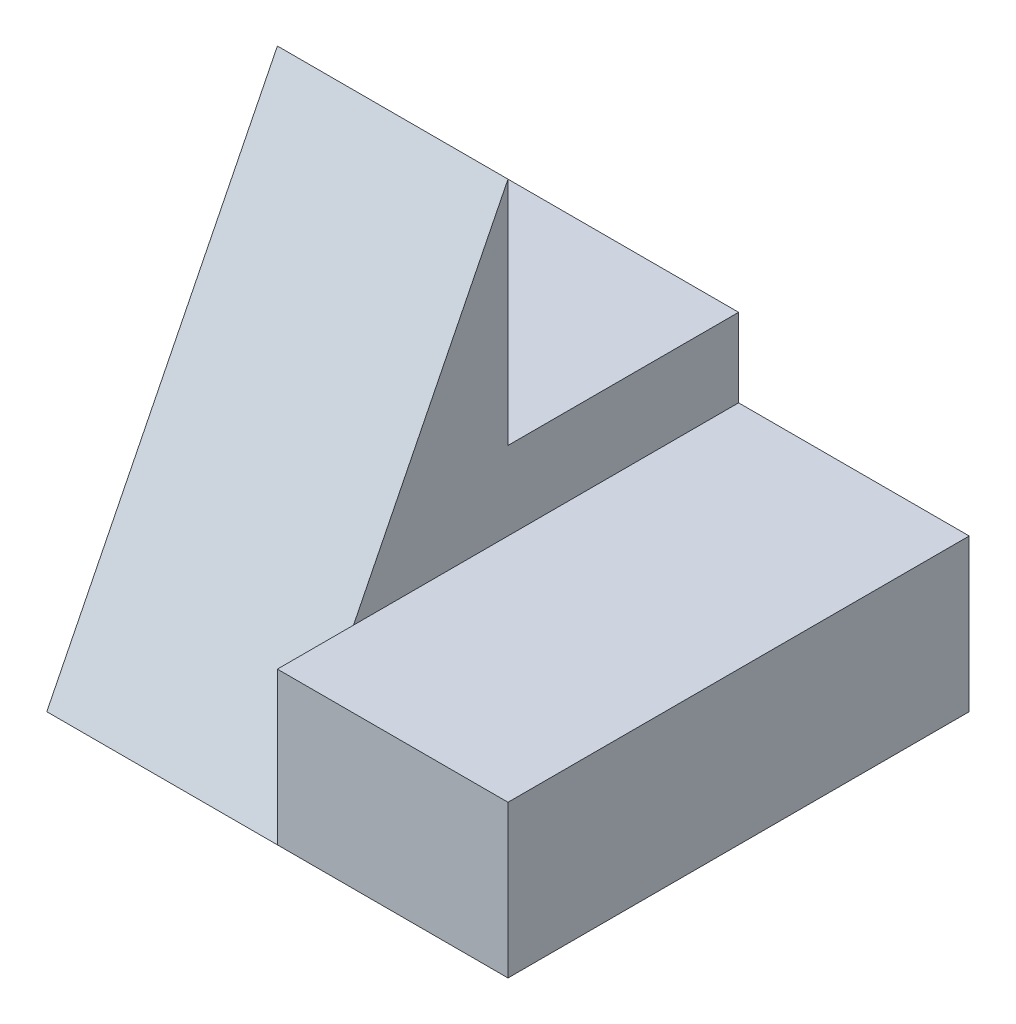
from build123d import *

# Parameters (mm, degrees)
SKETCH1_W               = 1
SKETCH1_H               = 1
BOSS_EXTRUDE1_DEPTH     = 1
CUT_EXTRUDE1_DEPTH      = 2.732050808
CUT_EXTRUDE1_DEPTH_BACK = 0.5
CUT_EXTRUDE2_DEPTH      = 2.732050808
CUT_EXTRUDE2_DEPTH_BACK = 0.5


with BuildPart() as part:
    # Sketch1 → Boss-Extrude1 (new body)
    with BuildSketch(Plane(origin=(0, 0, 0), x_dir=(1, 0, 0), z_dir=(0, 1, 0))):
        with Locations((0.5, 0.5)):
            Rectangle(SKETCH1_W, SKETCH1_H)
    extrude(amount=BOSS_EXTRUDE1_DEPTH)

    # Sketch2 → Cut-Extrude1 (cut, two sides: drawn at the far end of the back side and taken through both)
    with BuildSketch(Plane(origin=(1, 0, 0), x_dir=(0, 0, -1), z_dir=(1, 0, 0)).offset(-CUT_EXTRUDE1_DEPTH_BACK)):
        Polygon((-12.407405242, 0.33), (0, 0.33), (1, 0.33), (13.407405242, 0.33), (13.407405242, 25.144810484), (-12.407405242, 25.144810484), align=None)
    extrude(amount=CUT_EXTRUDE1_DEPTH + CUT_EXTRUDE1_DEPTH_BACK, mode=Mode.SUBTRACT)

    # Sketch3 → Cut-Extrude2 (cut, two sides: drawn at the far end of the back side and taken through both)
    with BuildSketch(Plane.ZY.offset(-CUT_EXTRUDE2_DEPTH_BACK)):
        Polygon((5.737047019, -11.474094038), (0, 0), (-0.5, 1), (-0.5, 0.5), (-1, 0.5), (-13.828427125, 0.5), (-0.435480574, 22.383855983), (19.12999357, 10.409761944), align=None)
    extrude(amount=CUT_EXTRUDE2_DEPTH + CUT_EXTRUDE2_DEPTH_BACK, mode=Mode.SUBTRACT)


solid = part.part
